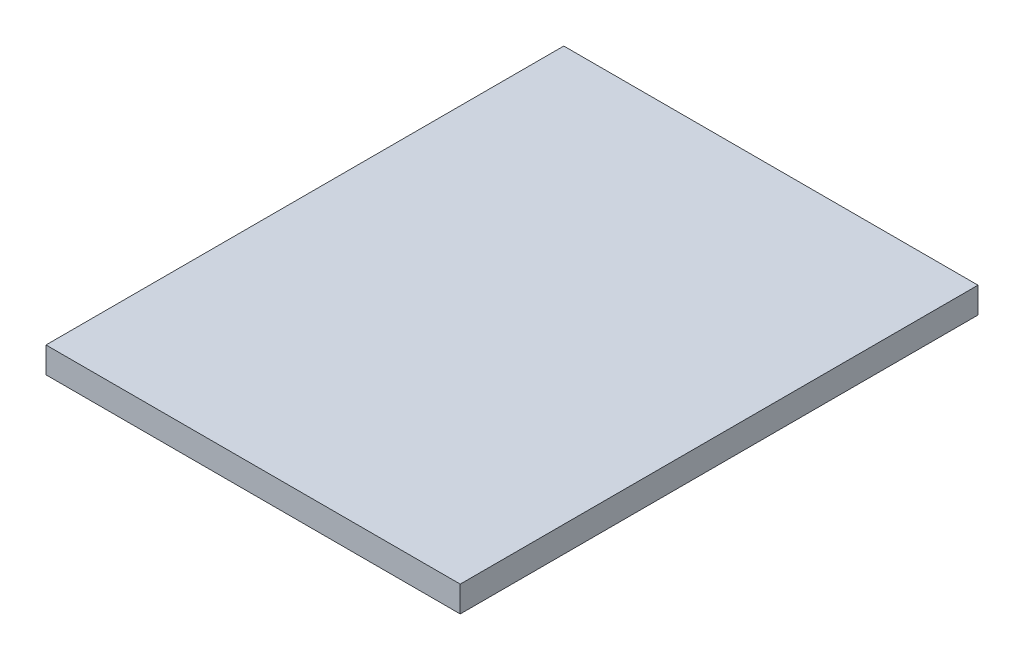
from build123d import *

# Parameters (mm, degrees)
SKETCH1_W           = 40.64
SKETCH1_H           = 50.8
BOSS_EXTRUDE1_DEPTH = 2.54


with BuildPart() as part:
    # Sketch1 → Boss-Extrude1 (new body)
    with BuildSketch(Plane(origin=(0, 0, 0), x_dir=(1, 0, 0), z_dir=(0, 1, 0))):
        with Locations((20.32, 25.4)):
            Rectangle(SKETCH1_W, SKETCH1_H)
    extrude(amount=BOSS_EXTRUDE1_DEPTH)


solid = part.part
